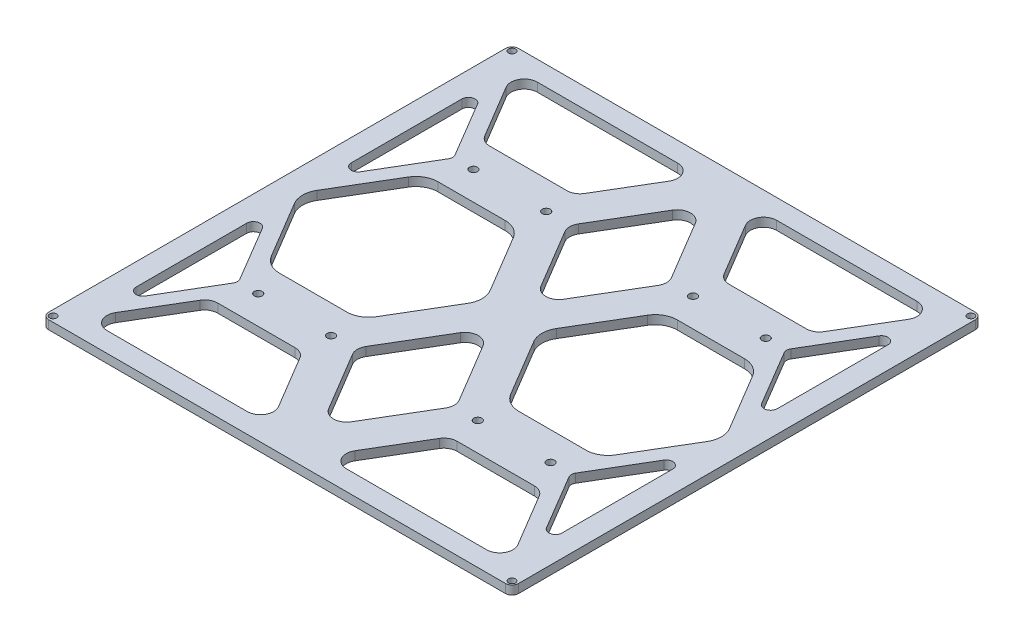
from build123d import *

# Parameters (mm, degrees)
SKETCH_1_W          = 214
SKETCH_1_H          = 214
EXTRUDE_1_DEPTH     = 4
FILLET_1_R          = 3
SKETCH_2_R          = 1.6
SKETCH_2_R_2        = 1.8
CUT_EXTRUDE_1_DEPTH = 152.373709739
CUT_EXTRUDE_2_DEPTH = 152.373709739
FILLET_2_R          = 10
FILLET_3_R          = 6
FILLET_4_R          = 3
FILLET_5_R          = 6


with BuildPart() as part:
    # 스케치1 → 보스-돌출1 (new body)
    with BuildSketch(Plane(origin=(0, 0, 0), x_dir=(1, 0, 0), z_dir=(0, 1, 0))):
        Rectangle(SKETCH_1_W, SKETCH_1_H)
    extrude(amount=EXTRUDE_1_DEPTH)

    # 필렛1
    fillet_1_edges = [part.edges().sort_by_distance(p)[0] for p in [
        (107, 2, 107),
        (-107, 2, 107),
        (-107, 2, -107),
        (107, 2, -107),
    ]]
    fillet(fillet_1_edges, radius=FILLET_1_R)

    # 스케치2 → 컷-돌출1 (cut, through all)
    with BuildSketch(Plane(origin=(0, 4, 0), x_dir=(1, 0, 0), z_dir=(0, 1, 0))):
        with Locations(Location((-104.5, 104.5, 0), (0, 0, 270))):
            Circle(SKETCH_2_R)
        with Locations(Location((104.5, -104.5, 0), (0, 0, 90))):
            Circle(SKETCH_2_R)
        with Locations(Location((-104.5, -104.5, 0), (0, 0, 270))):
            Circle(SKETCH_2_R)
        with Locations(Location((104.5, 104.5, 0), (0, 0, 90))):
            Circle(SKETCH_2_R)
        with Locations(Location((-66.575, 49, 0), (0, 0, 270))):
            Circle(SKETCH_2_R_2)
        with Locations(Location((66.575, 49, 0), (0, 0, 270))):
            Circle(SKETCH_2_R_2)
        with Locations(Location((-66.575, -49, 0), (0, 0, 270))):
            Circle(SKETCH_2_R_2)
        with Locations(Location((66.575, -49, 0), (0, 0, 270))):
            Circle(SKETCH_2_R_2)
        with Locations(Location((-33.425, 49, 0), (0, 0, 270))):
            Circle(SKETCH_2_R_2)
        with Locations(Location((33.425, 49, 0), (0, 0, 90))):
            Circle(SKETCH_2_R_2)
        with Locations(Location((-33.425, -49, 0), (0, 0, 270))):
            Circle(SKETCH_2_R_2)
        with Locations(Location((33.425, -49, 0), (0, 0, 90))):
            Circle(SKETCH_2_R_2)
    extrude(amount=-CUT_EXTRUDE_1_DEPTH, mode=Mode.SUBTRACT)

    # 스케치3 → 컷-돌출2 (cut, through all)
    with BuildSketch(Plane(origin=(0, 4, 0), x_dir=(1, 0, 0), z_dir=(0, 1, 0))):
        Polygon((-97, 98), (-12, 98), (-33.5, 61.920227273), (-75.5, 61.920227273), align=None)
        Polygon((97, 98), (12, 98), (33.5, 61.920227273), (75.5, 61.920227273), align=None)
        Polygon((-97, 85.124359856), (-97, 12.875640144), (-75.575, 49), align=None)
        Polygon((97, 85.124359856), (97, 12.875640144), (75.575, 49), align=None)
        Polygon((97, -85.124359856), (97, -12.875640144), (75.575, -49), align=None)
        Polygon((-75.5, -61.920227273), (-97, -98), (-12, -98), (-33.5, -61.920227273), align=None)
        Polygon((-97, -12.875640144), (-75.575, -49), (-97, -85.124359856), align=None)
        Polygon((75.5, -61.920227273), (97, -98), (12, -98), (33.5, -61.920227273), align=None)
        Polygon((-12, 0), (-33.5, 36.079772727), (-75.5, 36.079772727), (-97, 0), (-75.5, -36.079772727), (-33.5, -36.079772727), align=None)
        Polygon((75.5, 36.079772727), (97, 0), (75.5, -36.079772727), (33.5, -36.079772727), (12, 0), (33.5, 36.079772727), align=None)
        Polygon((0, 87), (-23.035714286, 48.34310065), (0, 9.6862013), (23.035714286, 48.34310065), align=None)
        Polygon((-23.035714286, -48.34310065), (0, -9.6862013), (23.035714286, -48.34310065), (0, -87), align=None)
    extrude(amount=-CUT_EXTRUDE_2_DEPTH, mode=Mode.SUBTRACT)

    # 필렛2
    fillet_2_edges = [part.edges().sort_by_distance(p)[0] for p in [
        (-12, 2, 0),
        (-33.5, 2, 36.079772727),
        (-75.5, 2, 36.079772727),
        (-97, 2, 0),
        (-75.5, 2, -36.079772727),
        (-33.5, 2, -36.079772727),
        (33.5, 2, -36.079772727),
        (75.5, 2, -36.079772727),
        (97, 2, 0),
        (75.5, 2, 36.079772727),
        (33.5, 2, 36.079772727),
        (12, 2, 0),
    ]]
    fillet(fillet_2_edges, radius=FILLET_2_R)

    # 필렛3
    fillet_3_edges = [part.edges().sort_by_distance(p)[0] for p in [
        (97, 2, -98),
        (75.5, 2, -61.920227273),
        (33.5, 2, -61.920227273),
        (12, 2, -98),
        (-75.5, 2, 61.920227273),
        (-33.5, 2, 61.920227273),
        (-12, 2, 98),
        (-97, 2, 98),
        (33.5, 2, 61.920227273),
        (75.5, 2, 61.920227273),
        (97, 2, 98),
        (12, 2, 98),
        (-75.5, 2, -61.920227273),
        (-97, 2, -98),
        (-12, 2, -98),
        (-33.5, 2, -61.920227273),
    ]]
    fillet(fillet_3_edges, radius=FILLET_3_R)

    # 필렛4
    fillet_4_edges = [part.edges().sort_by_distance(p)[0] for p in [
        (-97, 2, -85.124359856),
        (-75.575, 2, -49),
        (-97, 2, -12.875640144),
        (75.575, 2, -49),
        (97, 2, -85.124359856),
        (97, 2, -12.875640144),
        (97, 2, 85.124359856),
        (75.575, 2, 49),
        (97, 2, 12.875640144),
        (-97, 2, 85.124359856),
        (-97, 2, 12.875640144),
        (-75.575, 2, 49),
    ]]
    fillet(fillet_4_edges, radius=FILLET_4_R)

    # 필렛5
    fillet_5_edges = [part.edges().sort_by_distance(p)[0] for p in [
        (0, 2, -87),
        (23.035714286, 2, -48.34310065),
        (0, 2, -9.6862013),
        (-23.035714286, 2, -48.34310065),
        (0, 2, 87),
        (-23.035714286, 2, 48.34310065),
        (0, 2, 9.6862013),
        (23.035714286, 2, 48.34310065),
    ]]
    fillet(fillet_5_edges, radius=FILLET_5_R)


solid = part.part
